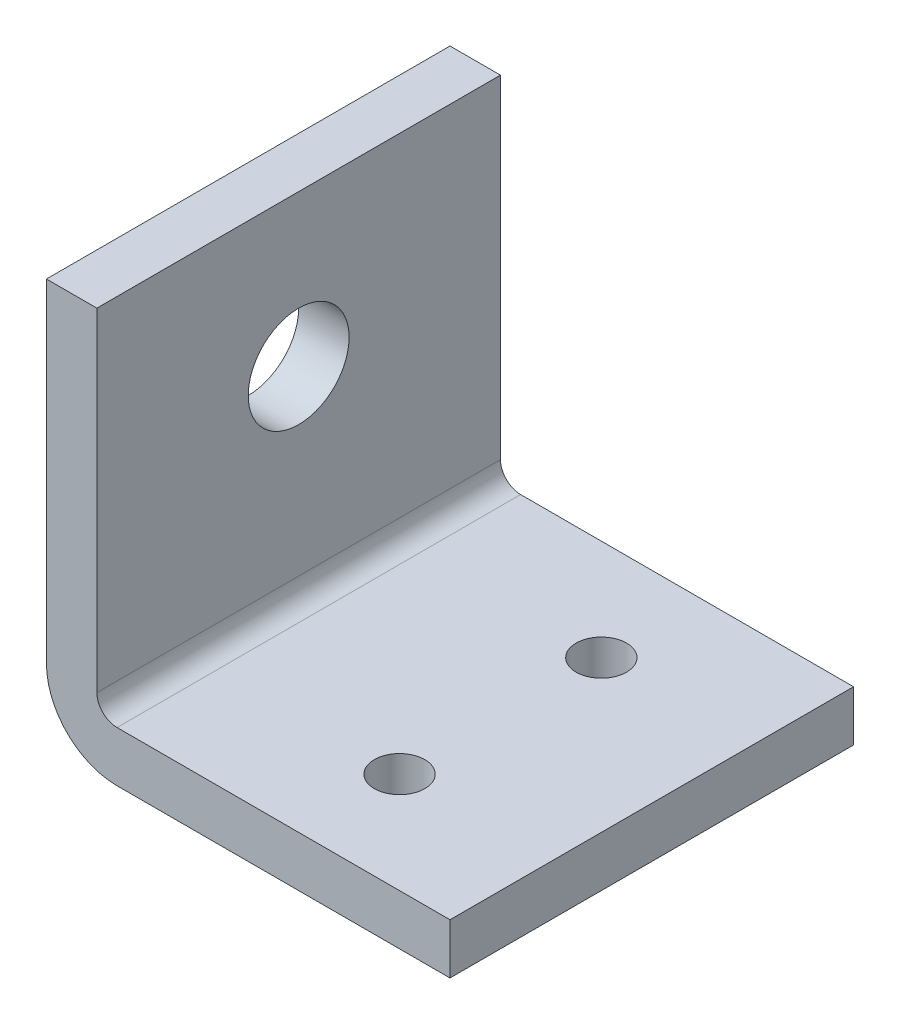
from build123d import *

# Parameters (mm, degrees)
SKETCH1_W           = 40
SKETCH1_H           = 40
BOSS_EXTRUDE1_DEPTH = 20
SKETCH2_W           = 35
SKETCH2_H           = 35
CUT_EXTRUDE1_DEPTH  = 40
FILLET1_R           = 2
FILLET2_R           = 7
HOLE1_D             = 10
HOLE2_D             = 5


with BuildPart() as part:
    # Sketch1 → Boss-Extrude1 (new, symmetric)
    with BuildSketch(Plane.XY):
        with Locations((20, 20)):
            Rectangle(SKETCH1_W, SKETCH1_H)
    extrude(amount=BOSS_EXTRUDE1_DEPTH, both=True)

    # Sketch2 → Cut-Extrude1 (cut)
    with BuildSketch(Plane.XY.offset(20)):
        with Locations((22.5, 22.5)):
            Rectangle(SKETCH2_W, SKETCH2_H)
    extrude(amount=-CUT_EXTRUDE1_DEPTH, mode=Mode.SUBTRACT)

    # Fillet1
    fillet1_edges = [part.edges().sort_by_distance(p)[0] for p in [
        (5, 5, 0),
    ]]
    fillet(fillet1_edges, radius=FILLET1_R)

    # Fillet2
    fillet2_edges = [part.edges().sort_by_distance(p)[0] for p in [
        (0, 0, 0),
    ]]
    fillet(fillet2_edges, radius=FILLET2_R)

    # Hole1 (through all)
    with Locations(Plane(origin=(5, 0, 0), x_dir=(0, 0, -1), z_dir=(1, 0, 0))):
        with Locations((0, 25)):
            Hole(HOLE1_D / 2)

    # Hole2 (through all)
    with Locations(Plane(origin=(0, 5, 0), x_dir=(1, 0, 0), z_dir=(0, 1, 0))):
        with Locations((25, -10)):
            hole2 = Hole(HOLE2_D / 2)

    # Mirror1: Hole2 across plane
    add(hole2.mirror(Plane.XY), mode=Mode.SUBTRACT)


solid = part.part
